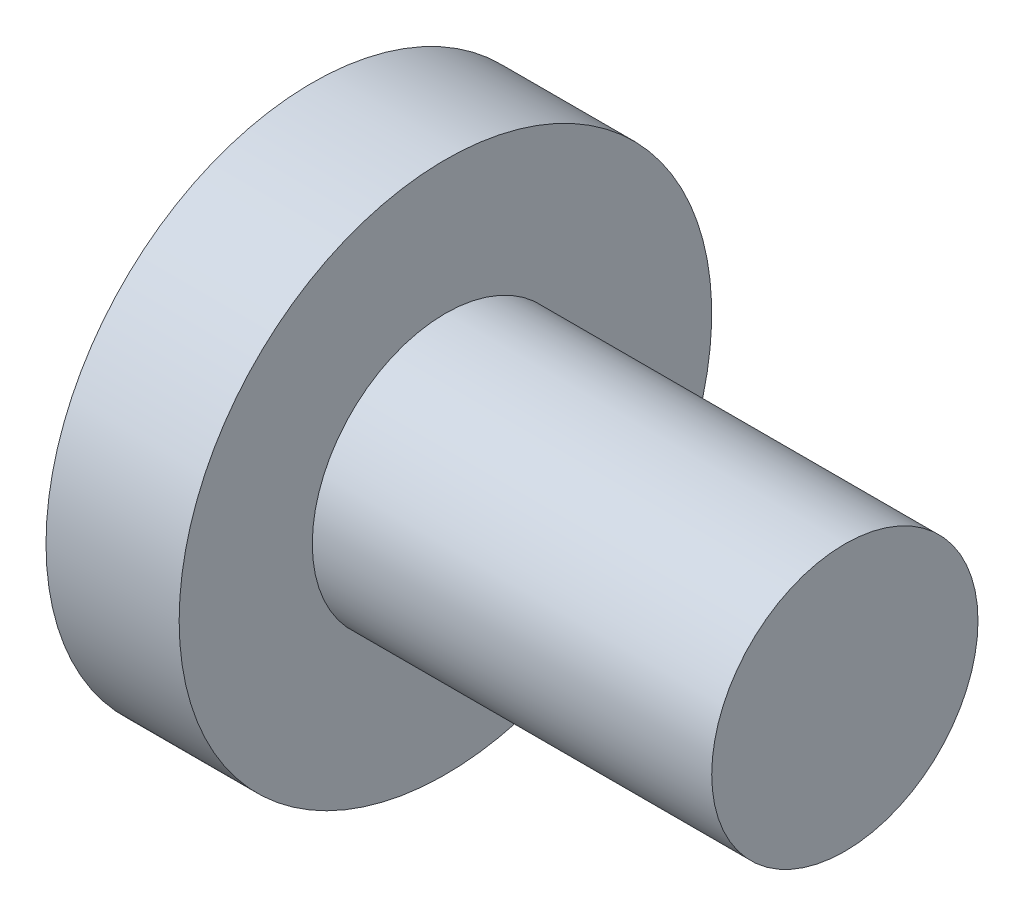
from build123d import *


with BuildPart() as part:
    # Sketch1 → Revolve1 (revolve)
    with BuildSketch(Plane(origin=(0, 0, 0), x_dir=(1, 0, 0), z_dir=(0, 1, 0)), mode=Mode.PRIVATE) as revolve1_sk:
        Polygon((-1.678140401, -0.019446706), (13.321859599, -0.019446706), (13.321859599, -5.019446706), (-4.380003755, -5.019446706), (-6.678140401, -5.019446706), (-6.678140401, 4.980553294), (-1.678140401, 4.980553294), align=None)
    revolve(revolve1_sk.sketch.rotate(Axis((-4.380003755, 0, 5.019446706), (1, 0, 0)), 180), axis=Axis((-4.380003755, 0, 5.019446706), (1, 0, 0)))


solid = part.part
